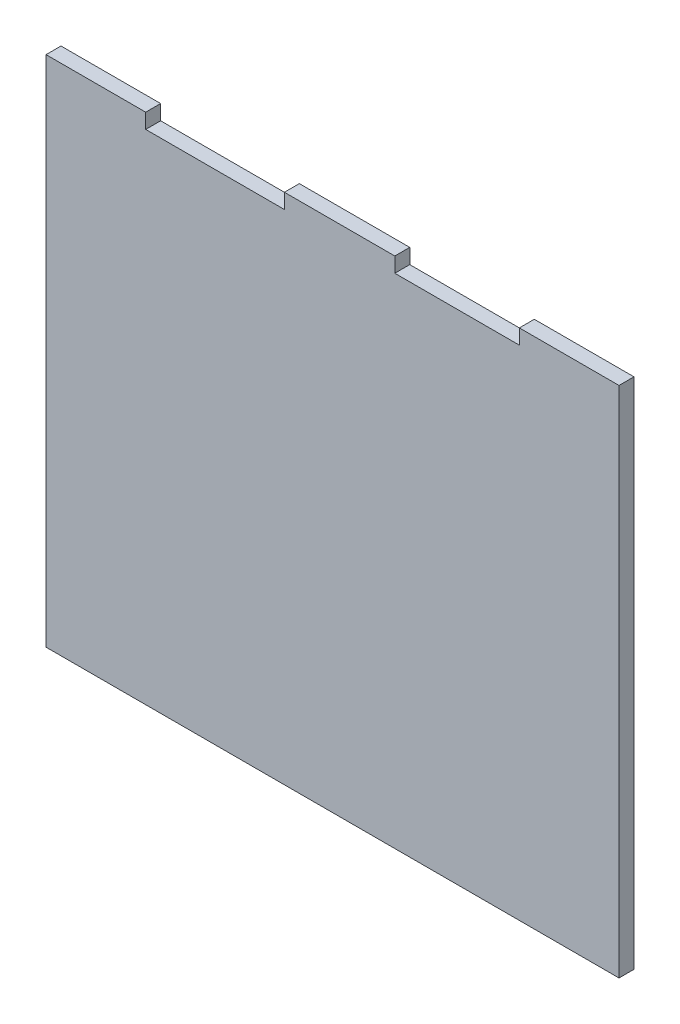
from build123d import *

# Parameters (mm, degrees)
SKETCH1_W           = 115
SKETCH1_H           = 100
SKETCH1_W_2         = 22.16
SKETCH1_H_2         = 3
SKETCH1_W_3         = 20
BOSS_EXTRUDE1_DEPTH = 3


with BuildPart() as part:
    # Sketch1 → Boss-Extrude1 (new body)
    with BuildSketch(Plane.XY):
        with Locations((1, 0)):
            Rectangle(SKETCH1_W, SKETCH1_H)
        with Locations((2.42, 51.5)):
            Rectangle(SKETCH1_W_2, SKETCH1_H_2)
        with Locations((48.5, 51.5)):
            Rectangle(SKETCH1_W_3, SKETCH1_H_2)
        with Locations((-46.5, 51.5)):
            Rectangle(SKETCH1_W_3, SKETCH1_H_2)
    extrude(amount=BOSS_EXTRUDE1_DEPTH)


solid = part.part
